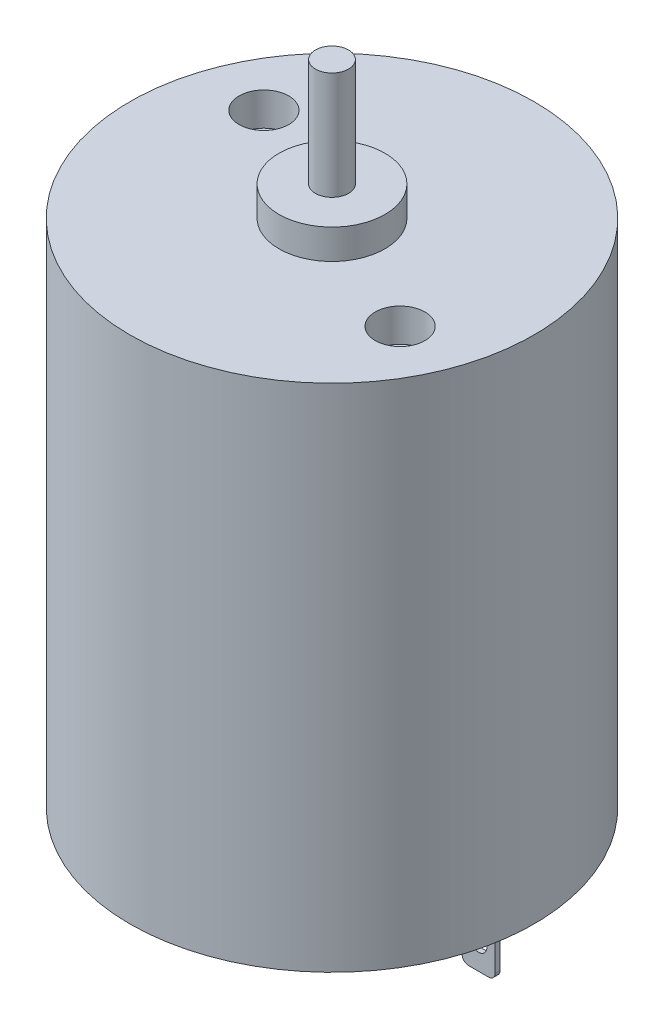
from build123d import *

# Parameters (mm, degrees)
SKETCH_1_R          = 12.2
EXTRUDE_1_DEPTH     = 30.8
SKETCH_2_R          = 3.2
EXTRUDE_2_DEPTH     = 1.8
SKETCH_3_R          = 1
EXTRUDE_3_DEPTH     = 6.5
SKETCH_4_R          = 1.5
CUT_EXTRUDE_1_DEPTH = 2
EXTRUDE_START       = 1.6
SKETCH_5_R          = 3.2
SKETCH_5_W          = 2
SKETCH_5_H          = 0.3
EXTRUDE_4_DEPTH     = 1.6
SKETCH_6_W          = 2
SKETCH_6_H          = 0.3
EXTRUDE_5_DEPTH     = 2.4
SKETCH_7_R          = 1
CUT_EXTRUDE_2_DEPTH = 2
SKETCH_8_R          = 0.5
CUT_EXTRUDE_4_DEPTH = 0.3
FILLET_4_R          = 0.4


with BuildPart() as part:
    # 草图1 → 凸台-拉伸1 (new body)
    with BuildSketch(Plane(origin=(0, 0, 0), x_dir=(1, 0, 0), z_dir=(0, 1, 0))):
        with Locations(Location((0, 0, 0), (0, 0, 90))):
            Circle(SKETCH_1_R)
    extrude(amount=EXTRUDE_1_DEPTH)

    # 草图2 → 凸台-拉伸2 (add)
    with BuildSketch(Plane(origin=(0, 30.8, 0), x_dir=(1, 0, 0), z_dir=(0, 1, 0))):
        with Locations(Location((0, 0, 0), (0, 0, 270))):
            Circle(SKETCH_2_R)
    extrude(amount=EXTRUDE_2_DEPTH)

    # 草图3 → 凸台-拉伸3 (add)
    with BuildSketch(Plane(origin=(0, 32.6, 0), x_dir=(1, 0, 0), z_dir=(0, 1, 0))):
        with Locations(Location((0, 0, 0), (0, 0, 90))):
            Circle(SKETCH_3_R)
    extrude(amount=EXTRUDE_3_DEPTH)

    # 草图4 → 切除-拉伸1 (cut)
    with BuildSketch(Plane(origin=(0, 30.8, 0), x_dir=(1, 0, 0), z_dir=(0, 1, 0))):
        with Locations(Location((7.70361619, -3.592255225, 0), (0, 0, 270))):
            Circle(SKETCH_4_R)
        with Locations(Location((-7.70361619, 3.592255225, 0), (0, 0, 270))):
            Circle(SKETCH_4_R)
    extrude(amount=-CUT_EXTRUDE_1_DEPTH, mode=Mode.SUBTRACT)

    # 草图5 → 凸台-拉伸4 (add)
    with BuildSketch(Plane.XZ.offset(EXTRUDE_START)):
        with Locations(Location((0, 0, 0), (0, 0, 90))):
            Circle(SKETCH_5_R)
        with Locations((-9, 0)):
            Rectangle(SKETCH_5_W, SKETCH_5_H)
        with Locations((9, 0)):
            Rectangle(SKETCH_5_W, SKETCH_5_H)
    extrude(amount=-EXTRUDE_4_DEPTH)

    # 草图6 → 凸台-拉伸5 (add)
    with BuildSketch(Plane.XZ.offset(1.6)):
        with Locations((-9, 0)):
            Rectangle(SKETCH_6_W, SKETCH_6_H)
        with Locations((9, 0)):
            Rectangle(SKETCH_6_W, SKETCH_6_H)
    extrude(amount=EXTRUDE_5_DEPTH)

    # 草图7 → 切除-拉伸2 (cut)
    with BuildSketch(Plane.XZ.offset(1.6)):
        with Locations(Location((0, 0, 0), (0, 0, 270))):
            Circle(SKETCH_7_R)
    extrude(amount=-CUT_EXTRUDE_2_DEPTH, mode=Mode.SUBTRACT)

    # 草图8 → 切除-拉伸4 (cut)
    with BuildSketch(Plane(origin=(0, 0, -0.15), x_dir=(-1, 0, 0), z_dir=(0, 0, -1))):
        with Locations((9, -2.5)):
            Circle(SKETCH_8_R)
        with Locations(Location((-9, -2.5, 0), (0, 0, 180))):
            Circle(SKETCH_8_R)
    extrude(amount=-CUT_EXTRUDE_4_DEPTH, mode=Mode.SUBTRACT)

    # 圆角4
    fillet_4_edges = [part.edges().sort_by_distance(p)[0] for p in [
        (-10, -4, 0),
        (-8, -4, 0),
        (10, -4, 0),
        (8, -4, 0),
    ]]
    fillet(fillet_4_edges, radius=FILLET_4_R)


solid = part.part
